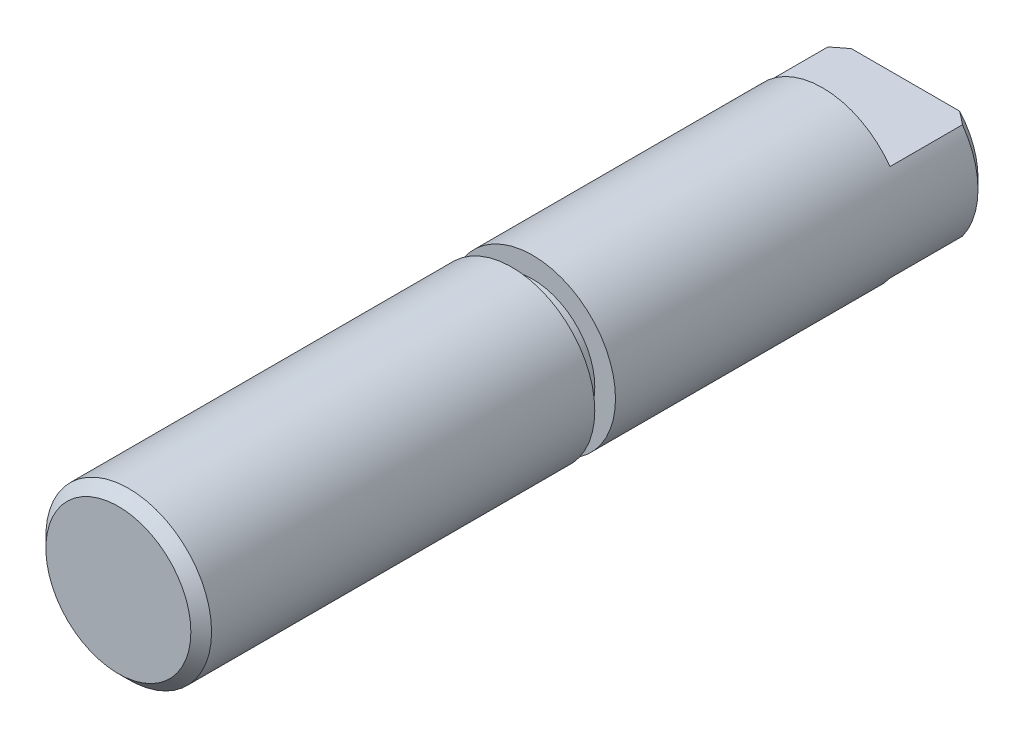
from build123d import *

# Parameters (mm, degrees)
ESQUISSE1_R             = 4
BASE_EXTRUSION_DEPTH    = 38
CHANFREIN1_SIZE         = 0.5
ESQUISSE2_OUTSIDE_W     = 17.93
ESQUISSE2_OUTSIDE_H     = 17.93
ESQUISSE2_OUTSIDE_R     = 3
ENL_V_MAT_EXTRU_1_DEPTH = 1
ESQUISSE3_OUTSIDE_W     = 17.93
ESQUISSE3_OUTSIDE_H     = 17.93
ENL_V_MAT_EXTRU_2_DEPTH = 4


with BuildPart() as part:
    # Esquisse1 → Base-Extrusion (new body)
    with BuildSketch(Plane.XY):
        with Locations(Location((0, 0, 0), (0, 0, 215.635694855))):
            Circle(ESQUISSE1_R)
    extrude(amount=BASE_EXTRUSION_DEPTH)

    # Chanfrein1
    chanfrein1_edges = [part.edges().sort_by_distance(p)[0] for p in [
        (3.25095178, 2.330517652, 0),
        (3.25095178, 2.330517652, 38),
    ]]
    chamfer(chanfrein1_edges, length=CHANFREIN1_SIZE)

    # Esquisse2 outside → Enlèv. mat.-Extru.1 (cut)
    with BuildSketch(Plane.XY.offset(19)):
        Rectangle(ESQUISSE2_OUTSIDE_W, ESQUISSE2_OUTSIDE_H)
        Circle(ESQUISSE2_OUTSIDE_R, mode=Mode.SUBTRACT)
    extrude(amount=-ENL_V_MAT_EXTRU_1_DEPTH, mode=Mode.SUBTRACT)

    # Esquisse3 outside → Enlèv. mat.-Extru.2 (cut)
    with BuildSketch(Plane(origin=(0, 0, 0), x_dir=(-1, 0, 0), z_dir=(0, 0, -1))):
        Rectangle(ESQUISSE3_OUTSIDE_W, ESQUISSE3_OUTSIDE_H)
        with BuildLine():
            Line((-3.25095178, 2.330517652), (3.25095178, 2.330517652))
            ThreePointArc((3.25095178, 2.330517652), (4, 0), (3.25095178, -2.330517652))
            Line((3.25095178, -2.330517652), (-3.25095178, -2.330517652))
            ThreePointArc((-3.25095178, -2.330517652), (-4, 0), (-3.25095178, 2.330517652))
        make_face(mode=Mode.SUBTRACT)
    extrude(amount=-ENL_V_MAT_EXTRU_2_DEPTH, mode=Mode.SUBTRACT)


solid = part.part
